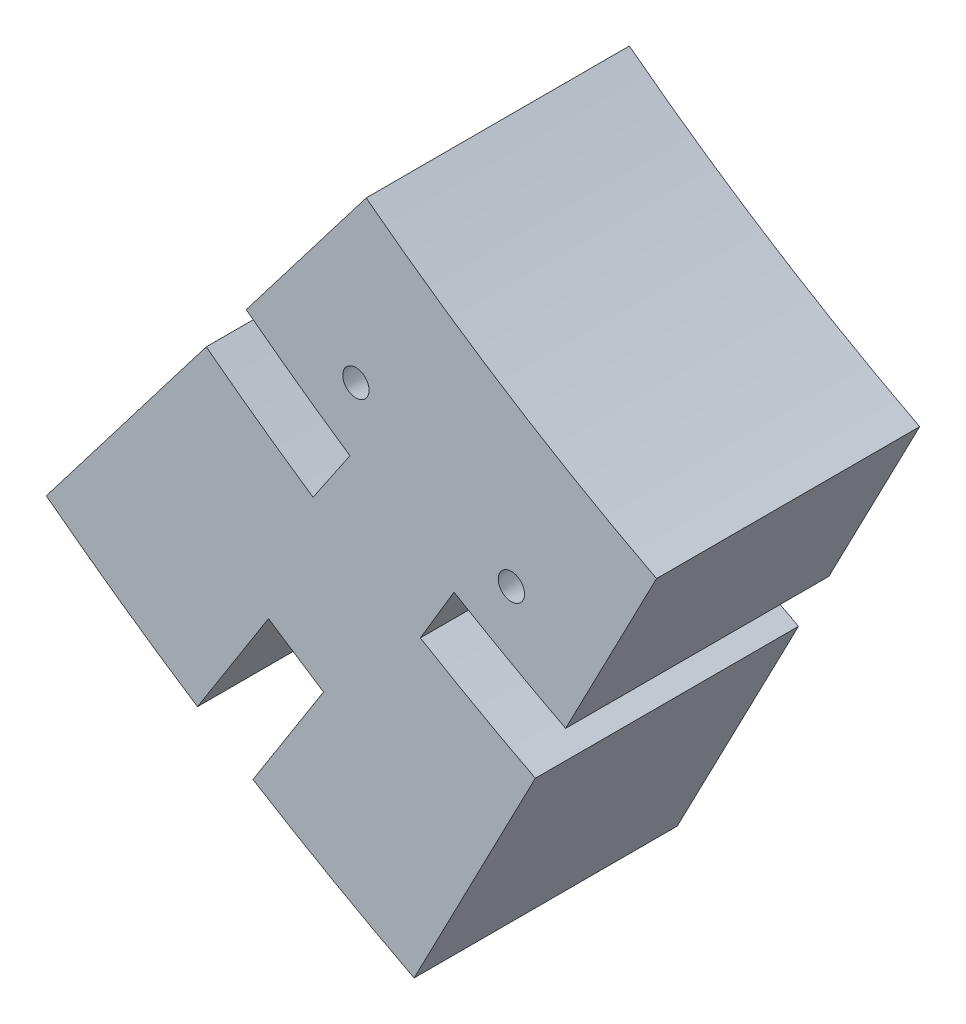
from build123d import *

# Parameters (mm, degrees)
EXTRUDE_1_DEPTH     = 100
CUT_EXTRUDE_1_DEPTH = 1027.825534296
CUT_EXTRUDE_2_DEPTH = 100


with BuildPart() as part:
    # 草图1 → 凸台-拉伸1 (new body)
    with BuildSketch(Plane.XY):
        with BuildLine():
            Line((-455.837805225, -595.576943247), (-577.394553286, -754.397461446))
            ThreePointArc((-577.394553286, -754.397461446), (-509.447321611, -801.850002496), (-437.622888206, -843.199980858))
            Line((-437.622888206, -843.199980858), (-345.491753847, -665.684195414))
            ThreePointArc((-345.491753847, -665.684195414), (-402.195253903, -633.039475655), (-455.837805225, -595.576943247))
        make_face()
    extrude(amount=EXTRUDE_1_DEPTH)

    # 草图2 → 切除-拉伸1 (cut, through all)
    with BuildSketch(Plane.XY.offset(100)):
        Polygon((-472.039544491, -766.28120979), (-498.852561418, -808.4838415), (-500.293413788, -812.59937229), (-523.195250823, -798.324469225), (-519.950393134, -795.079611536), (-492.967880598, -752.602438021), align=None)
    extrude(amount=-CUT_EXTRUDE_1_DEPTH, mode=Mode.SUBTRACT)

    # 草图4 → 切除-旋转1 (revolve, cut)
    with BuildSketch(Plane(origin=(-29.5994078, 18.802248971, 0), x_dir=(0, 0, -1), z_dir=(0.8440969905384018, -0.5361905170403645, 0)), mode=Mode.PRIVATE) as cut_revolve_1_sk:
        Polygon((-100, -802.210780827), (-100, -797.210780827), (-50.759612349, -788.528371944), (0, -788.528371944), (0, -802.210780827), align=None)
    cut_revolve_1 = revolve(cut_revolve_1_sk.sketch.rotate(Axis((-459.737221147, -658.341456902, 100), (0, 0, -1)), 57.57531458), axis=Axis((-459.737221147, -658.341456902, 100), (0, 0, -1)), mode=Mode.SUBTRACT)

    # 镜向1: 切除-旋转1 across plane
    add(cut_revolve_1.mirror(Plane(origin=(0, 0, 0), x_dir=(0, 0, 1), z_dir=(-0.8440526342067589, 0.5362603385377582, 0))), mode=Mode.SUBTRACT)

    # 草图6 → 切除-拉伸2 (cut)
    with BuildSketch(Plane.XY.offset(100)):
        with BuildLine():
            Line((-501.421585748, -655.134637572), (-516.607469043, -674.975821978))
            ThreePointArc((-516.607469043, -674.975821978), (-496.522608458, -689.884727049), (-476.007750242, -704.196179367))
            Line((-476.007750242, -704.196179367), (-462.015311929, -683.496050861))
            ThreePointArc((-462.015311929, -683.496050861), (-481.927127678, -669.605289411), (-501.421585748, -655.134637572))
        make_face()
        with BuildLine():
            Line((-380.040929232, -732.252614955), (-391.550719321, -754.429368148))
            ThreePointArc((-391.550719321, -754.429368148), (-413.579890996, -742.581518144), (-435.250907035, -730.090600714))
            Line((-435.250907035, -730.090600714), (-422.456532439, -708.62929533))
            ThreePointArc((-422.456532439, -708.62929533), (-401.422544589, -720.753037243), (-380.040929232, -732.252614955))
        make_face()
    extrude(amount=-CUT_EXTRUDE_2_DEPTH, mode=Mode.SUBTRACT)


solid = part.part
